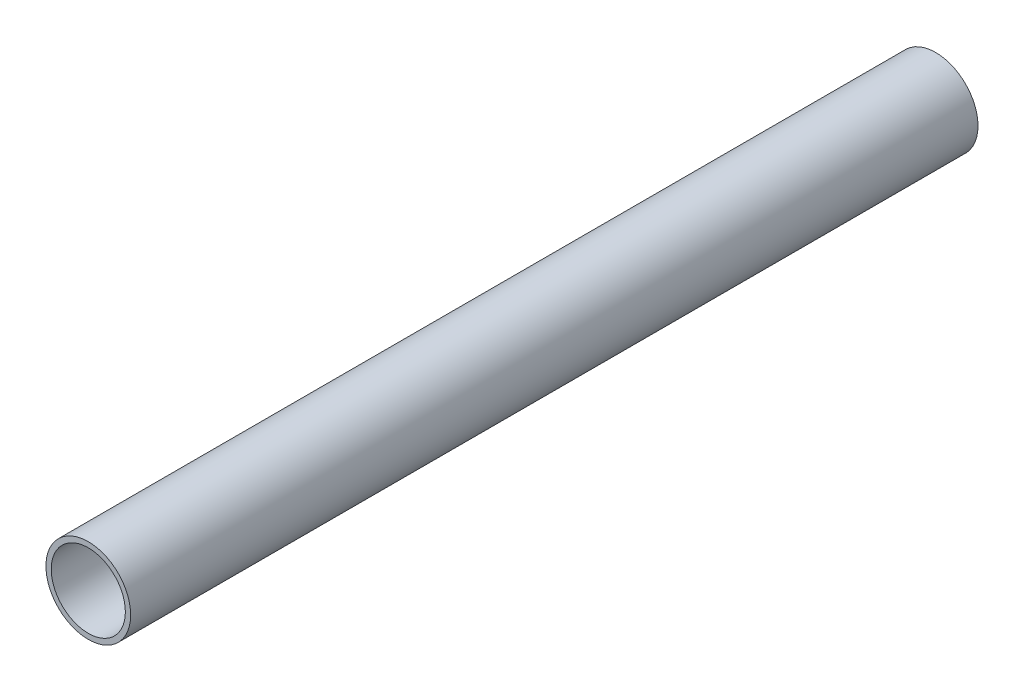
from build123d import *

# Parameters (mm, degrees)
SKETCH2_R           = 12.7
SKETCH2_R_2         = 11.1125
BOSS_EXTRUDE1_DEPTH = 127
SKETCH3_R           = 2.15265
CUT_EXTRUDE1_DEPTH  = 129.263712717


with BuildPart() as part:
    # Sketch2 → Boss-Extrude1 (new, symmetric)
    with BuildSketch(Plane.XY):
        Circle(SKETCH2_R)
        Circle(SKETCH2_R_2, mode=Mode.SUBTRACT)
    extrude(amount=BOSS_EXTRUDE1_DEPTH, both=True)

    # Sketch3 → Cut-Extrude1 (cut, through all)
    with BuildSketch(Plane(origin=(0, 0, 0), x_dir=(1, 0, 0), z_dir=(0, 1, 0))):
        with Locations(Location((0, 0, 0), (0, 0, 270))):
            Circle(SKETCH3_R)
    extrude(amount=-CUT_EXTRUDE1_DEPTH, mode=Mode.SUBTRACT)


solid = part.part
